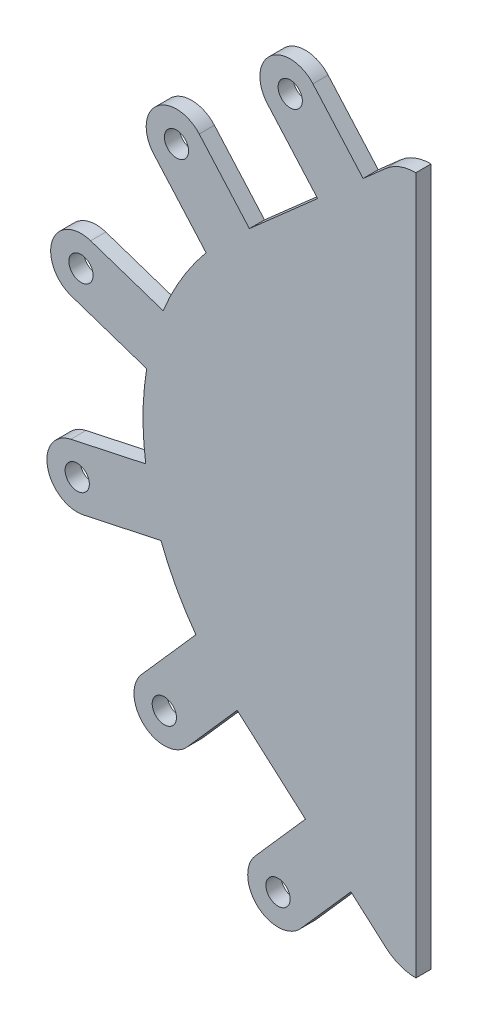
from build123d import *

# Parameters (mm, degrees)
EXTRUDE_1_DEPTH  = 0.5
SKETCH_2_R       = 0.4
EXTRUDE_3_DEPTH  = 0.5
SKETCH_3_R       = 0.4
EXTRUDE_12_DEPTH = 0.5


with BuildPart() as part:
    # Эскиз1 → Вытянуть1 (new body)
    with BuildSketch(Plane.XY):
        with BuildLine():
            Line((0, 11.5), (0, -11.5))
            ThreePointArc((0, -11.5), (-0.530330086, -11.40312152), (-0.992156742, -11.125))
            Line((-0.992156742, -11.125), (-5.95294045, -6.75))
            ThreePointArc((-5.95294045, -6.75), (-9, 0), (-5.95294045, 6.75))
            Line((-5.95294045, 6.75), (-0.992156742, 11.125))
            ThreePointArc((-0.992156742, 11.125), (-0.530330086, 11.40312152), (0, 11.5))
        make_face()
    extrude(amount=EXTRUDE_1_DEPTH)

    # Эскиз2 → Вытянуть3 (add)
    with BuildSketch(Plane.XY.offset(0.5)):
        with BuildLine():
            Line((-3.395751311, 12.338562172), (-1.742156742, 10.463562172))
            Line((-1.742156742, 10.463562172), (-3.242156742, 9.140686517))
            Line((-3.242156742, 9.140686517), (-4.895751311, 11.015686517))
            ThreePointArc((-4.895751311, 11.015686517), (-4.807189139, 12.427124344), (-3.395751311, 12.338562172))
        make_face()
        with Locations((-4.145751311, 11.677124344)):
            Circle(SKETCH_2_R, mode=Mode.SUBTRACT)
    extrude(amount=-EXTRUDE_3_DEPTH)

    # Эскиз3 → Вытянуть12 (add)
    with BuildSketch(Plane(origin=(0, 0, 0), x_dir=(-1, 0, 0), z_dir=(0, 0, -1))):
        with BuildLine():
            Line((7.145751311, 9.031373033), (5.492156742, 7.156373033))
            Line((5.492156742, 7.156373033), (2.144002144, -10.109167839))
            Line((2.144002144, -10.109167839), (3.797596713, -11.984167839))
            ThreePointArc((3.797596713, -11.984167839), (5.209034541, -12.072730011), (5.297596713, -10.661292183))
            Line((5.297596713, -10.661292183), (3.644002144, -8.786292183))
            Line((3.644002144, -8.786292183), (5.894002144, -6.8019787))
            Line((5.894002144, -6.8019787), (7.547596713, -8.6769787))
            ThreePointArc((7.547596713, -8.6769787), (8.959034541, -8.765540872), (9.047596713, -7.354103045))
            Line((9.047596713, -7.354103045), (7.061797178, -5.10241802))
            Line((7.061797178, -5.10241802), (7.50995229, -3.016480181))
            Line((7.50995229, -3.016480181), (10.959544642, -3.757610821))
            ThreePointArc((10.959544642, -3.757610821), (12.14728738, -2.989973414), (11.379649973, -1.802230676))
            Line((11.379649973, -1.802230676), (8.149841538, -1.108319701))
            Line((8.149841538, -1.108319701), (8.688125789, 1.397124189))
            Line((8.688125789, 1.397124189), (11.36395596, 2.295342711))
            ThreePointArc((11.36395596, 2.295342711), (11.993742241, 3.561584883), (10.727500069, 4.191371165))
            Line((10.727500069, 4.191371165), (8.034608294, 3.28742543))
            Line((8.034608294, 3.28742543), (6.559673056, 5.343106973))
            Line((6.559673056, 5.343106973), (8.645751311, 7.708497378))
            ThreePointArc((8.645751311, 7.708497378), (8.557189139, 9.119935206), (7.145751311, 9.031373033))
        make_face()
        with Locations((7.895751311, 8.369935206)):
            Circle(SKETCH_3_R, mode=Mode.SUBTRACT)
        with Locations((11.045728014, 3.243356938)):
            Circle(SKETCH_3_R, mode=Mode.SUBTRACT)
        with Locations((11.169597308, -2.779920749)):
            Circle(SKETCH_3_R, mode=Mode.SUBTRACT)
        with Locations((8.297596713, -8.015540872)):
            Circle(SKETCH_3_R, mode=Mode.SUBTRACT)
        with Locations((4.547596713, -11.322730011)):
            Circle(SKETCH_3_R, mode=Mode.SUBTRACT)
    extrude(amount=-EXTRUDE_12_DEPTH)


solid = part.part
